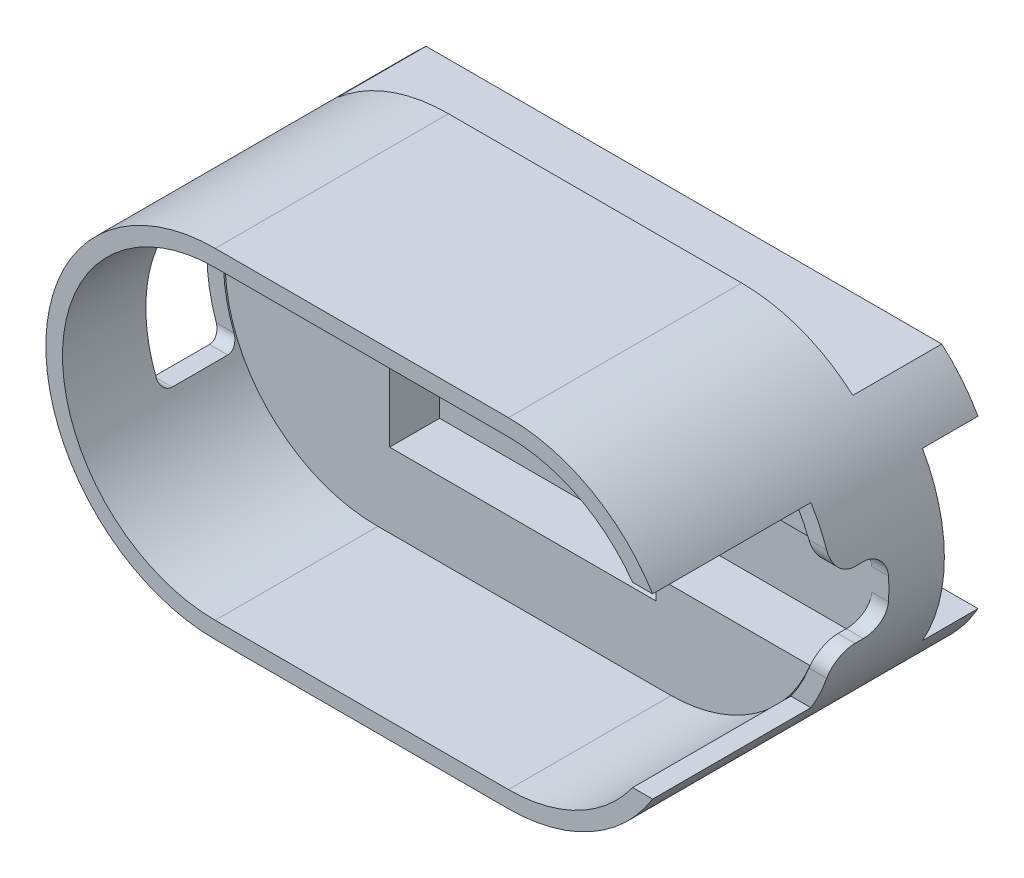
from build123d import *

# Parameters (mm, degrees)
BOSS_EXTRUDE1_DEPTH = 19
BOSS_EXTRUDE2_DEPTH = 2
BOSS_EXTRUDE3_DEPTH = 4.5
SKETCH4_W           = 4.75
SKETCH4_H           = 6
SKETCH4_W_2         = 14.25
SKETCH4_H_2         = 16
CUT_EXTRUDE1_DEPTH  = 49.452157546
SKETCH5_W           = 7
SKETCH5_H           = 12
CUT_EXTRUDE2_DEPTH  = 49.452157546
FILLET1_R           = 1
SKETCH6_R           = 1.25
BOSS_EXTRUDE4_DEPTH = 3
BOSS_EXTRUDE7_DEPTH = 8
FILLET2_R           = 2
SKETCH9_R           = 1.252428217
CUT_EXTRUDE3_DEPTH  = 10


with BuildPart() as part:
    # Sketch1 → Boss-Extrude1 (new body)
    with BuildSketch(Plane.XY):
        with BuildLine():
            Line((-34.384444189, 18.719216619), (-7.984444189, 18.719216619))
            ThreePointArc((-7.984444189, 18.719216619), (7.265555811, 3.469216619), (-7.984444189, -11.780783381))
            Line((-7.984444189, -11.780783381), (-34.384444189, -11.780783381))
            ThreePointArc((-34.384444189, -11.780783381), (-49.634444189, 3.469216619), (-34.384444189, 18.719216619))
        make_face()
        with BuildLine():
            Line((-34.384444189, 17.219216619), (-7.984444189, 17.219216619))
            ThreePointArc((-7.984444189, 17.219216619), (5.765555811, 3.469216619), (-7.984444189, -10.280783381))
            Line((-7.984444189, -10.280783381), (-34.384444189, -10.280783381))
            ThreePointArc((-34.384444189, -10.280783381), (-48.134444189, 3.469216619), (-34.384444189, 17.219216619))
        make_face(mode=Mode.SUBTRACT)
    extrude(amount=BOSS_EXTRUDE1_DEPTH)



with BuildPart() as body_2:
    # Sketch2 → Boss-Extrude2 (new body)
    with BuildSketch(Plane(origin=(0, 0, 0), x_dir=(-1, 0, 0), z_dir=(0, 0, -1))):
        with BuildLine():
            Line((34.384444189, -11.780783381), (7.984444189, -11.780783381))
            ThreePointArc((7.984444189, -11.780783381), (-7.265555811, 3.469216619), (7.984444189, 18.719216619))
            Line((7.984444189, 18.719216619), (34.384444189, 18.719216619))
            ThreePointArc((34.384444189, 18.719216619), (49.634444189, 3.469216619), (34.384444189, -11.780783381))
        make_face()
    extrude(amount=BOSS_EXTRUDE2_DEPTH)


with BuildPart() as part_1:
    add(part.part)

    add(body_2.part)  # Boss-Extrude3 merges body 2
    # Sketch3 → Boss-Extrude3 (add)
    with BuildSketch(Plane.XY):
        with BuildLine():
            Line((-22.664695889, -3.430783381), (-33.184444189, -3.430783381))
            Line((-33.184444189, -3.430783381), (-33.184444189, 10.369216619))
            Line((-33.184444189, 10.369216619), (-19.704192488, 10.369216619))
            Line((-19.704192488, 10.369216619), (-9.184444189, 10.369216619))
            Line((-9.184444189, 10.369216619), (-9.184444189, 8.469216619))
            Line((-9.184444189, 8.469216619), (4.663184056, 8.469216619))
            ThreePointArc((4.663184056, 8.469216619), (-0.337155761, 14.715615149), (-7.984444189, 17.069308538))
            Line((-7.984444189, 17.069308538), (-34.384444189, 17.069308538))
            ThreePointArc((-34.384444189, 17.069308538), (-47.984536108, 3.469216619), (-34.384444189, -10.1308753))
            Line((-34.384444189, -10.1308753), (-7.984444189, -10.1308753))
            ThreePointArc((-7.984444189, -10.1308753), (-0.337155761, -7.777181911), (4.663184056, -1.530783381))
            Line((4.663184056, -1.530783381), (-9.184444189, -1.530783381))
            Line((-9.184444189, -1.530783381), (-9.184444189, -3.430783381))
            Line((-9.184444189, -3.430783381), (-19.704192488, -3.430783381))
            Line((-19.704192488, -3.430783381), (-22.664695889, -3.430783381))
        make_face()
    extrude(amount=BOSS_EXTRUDE3_DEPTH)

    # Sketch4 → Cut-Extrude1 (cut, through all)
    with BuildSketch(Plane.ZY.offset(9.184444189)):
        with Locations((2.375, 3.469216619)):
            Rectangle(SKETCH4_W, SKETCH4_H)
        with Locations((11.875, 3.469216619)):
            Rectangle(SKETCH4_W_2, SKETCH4_H_2)
    extrude(amount=-CUT_EXTRUDE1_DEPTH, mode=Mode.SUBTRACT)

    # Sketch5 → Cut-Extrude2 (cut, through all)
    with BuildSketch(Plane(origin=(-33.184444189, 0, 0), x_dir=(0, 0, -1), z_dir=(1, 0, 0))):
        with Locations((-8, 3.469216619)):
            Rectangle(SKETCH5_W, SKETCH5_H)
    extrude(amount=-CUT_EXTRUDE2_DEPTH, mode=Mode.SUBTRACT)

    # Fillet1
    fillet1_edges = [part_1.edges().sort_by_distance(p)[0] for p in [
        (-47.580403151, -2.530783381, 11.5),
        (-47.580403151, 9.469216619, 11.5),
        (-47.580403151, 9.469216619, 4.5),
        (-47.580403151, -2.530783381, 4.5),
    ]]
    fillet(fillet1_edges, radius=FILLET1_R)

    # Sketch6 → Boss-Extrude4 (add)
    with BuildSketch(Plane(origin=(0, 0, -2), x_dir=(-1, 0, 0), z_dir=(0, 0, -1))):
        with BuildLine():
            ThreePointArc((47.662715914, -4.030783381), (49.634444189, 3.469216619), (47.662715914, 10.969216619))
            Line((47.662715914, 10.969216619), (-5.293827536, 10.969216619))
            ThreePointArc((-5.293827536, 10.969216619), (-7.265555811, 3.469216619), (-5.293827536, -4.030783381))
            Line((-5.293827536, -4.030783381), (47.662715914, -4.030783381))
        make_face()
        with Locations((21.184444189, 3.469216619)):
            Circle(SKETCH6_R, mode=Mode.SUBTRACT)
    extrude(amount=BOSS_EXTRUDE4_DEPTH)

    # Sketch10 → Boss-Extrude7 (add)
    with BuildSketch(Plane(origin=(0, 0, -2), x_dir=(-1, 0, 0), z_dir=(0, 0, -1))):
        with BuildLine():
            Line((-5.293827536, -4.030783381), (47.662715914, -4.030783381))
            ThreePointArc((47.662715914, -4.030783381), (46.201857789, -6.169830834), (44.400057001, -8.030783381))
            Line((44.400057001, -8.030783381), (-2.031168623, -8.030783381))
            ThreePointArc((-2.031168623, -8.030783381), (-3.832969412, -6.169830834), (-5.293827536, -4.030783381))
        make_face()
        with BuildLine():
            Line((-5.293827536, 10.969216619), (47.662715914, 10.969216619))
            ThreePointArc((47.662715914, 10.969216619), (46.201857789, 13.108264072), (44.400057001, 14.969216619))
            Line((44.400057001, 14.969216619), (-2.031168623, 14.969216619))
            ThreePointArc((-2.031168623, 14.969216619), (-3.832969412, 13.108264072), (-5.293827536, 10.969216619))
        make_face()
    extrude(amount=BOSS_EXTRUDE7_DEPTH)

    # Fillet2
    fillet2_edges = [part_1.edges().sort_by_distance(p)[0] for p in [
        (6.200927538, 0.469216619, 0),
        (6.200927538, 6.469216619, 0),
        (6.200927538, 6.469216619, 4.75),
        (6.200927538, 0.469216619, 4.75),
    ]]
    fillet(fillet2_edges, radius=FILLET2_R)

    # Sketch9 → Cut-Extrude3 (cut)
    with BuildSketch(Plane(origin=(0, 0, -2), x_dir=(-1, 0, 0), z_dir=(0, 0, -1))):
        with Locations((21.184444189, 3.469216619)):
            Circle(SKETCH9_R)
    extrude(amount=-CUT_EXTRUDE3_DEPTH, mode=Mode.SUBTRACT)


solid = part_1.part
